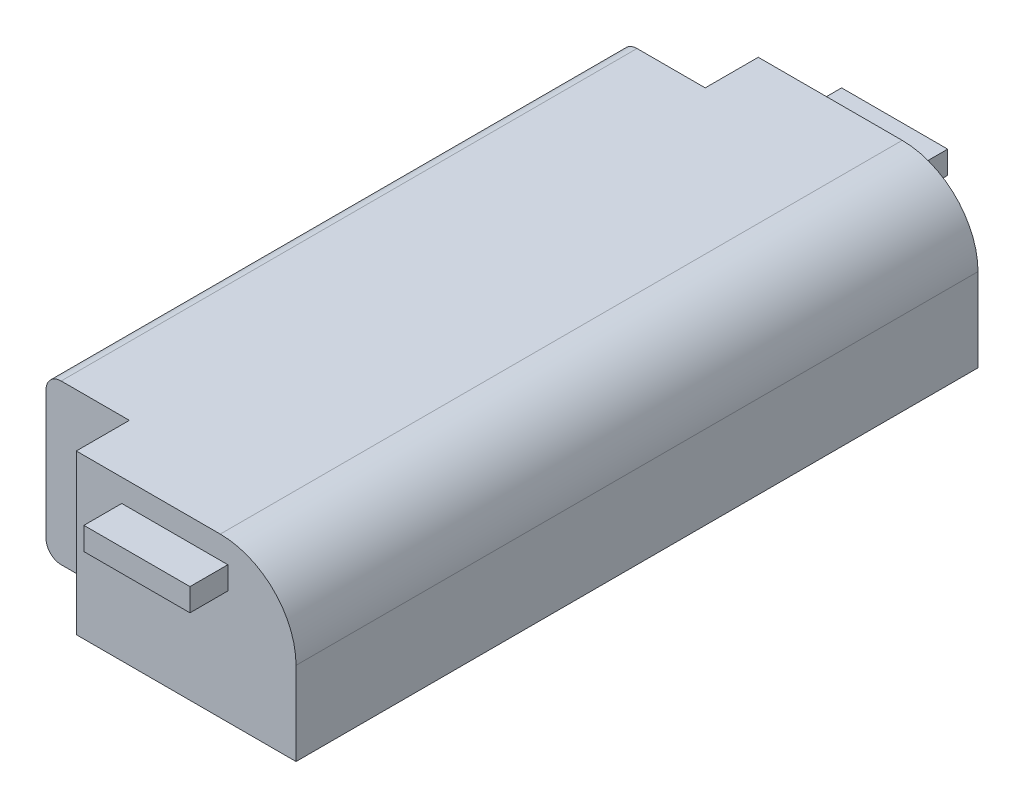
from build123d import *

# Parameters (mm, degrees)
BOSS_EXTRUDE1_DEPTH = 96.52
SKETCH3_W           = 36.83
SKETCH3_H           = 26.67
BOSS_EXTRUDE3_DEPTH = 8.89
SKETCH2_W           = 17.78
SKETCH2_H           = 3.81
BOSS_EXTRUDE4_DEPTH = 6.35
FILLET1_R           = 12.7
FILLET2_R           = 2.54


with BuildPart() as part:
    # Sketch1 → Boss-Extrude1 (new body)
    with BuildSketch(Plane.XY):
        Polygon((0, 0), (0, -20.32), (-7.62, -20.32), (-7.62, 6.35), (43.18, 6.35), (43.18, -20.32), (6.35, -20.32), (6.35, 0), align=None)
    extrude(amount=BOSS_EXTRUDE1_DEPTH)

    # Sketch3 → Boss-Extrude3 (add)
    with BuildSketch(Plane.XY.offset(96.52)):
        with Locations((24.765, -6.985)):
            Rectangle(SKETCH3_W, SKETCH3_H)
    boss_extrude3 = extrude(amount=BOSS_EXTRUDE3_DEPTH)

    # Sketch2 → Boss-Extrude4 (add)
    with BuildSketch(Plane(origin=(0, 0, 105.41), x_dir=(-1, 0, 0), z_dir=(0, 0, -1))):
        with Locations((-22.86, 0.635)):
            Rectangle(SKETCH2_W, SKETCH2_H)
    boss_extrude4 = extrude(amount=-BOSS_EXTRUDE4_DEPTH)

    # Mirror2: Boss-Extrude3, Boss-Extrude4 across plane
    add(boss_extrude3.mirror(Plane(origin=(0, 0, 48.26), x_dir=(1, 0, 0), z_dir=(0, 0, -1))))
    add(boss_extrude4.mirror(Plane(origin=(0, 0, 48.26), x_dir=(1, 0, 0), z_dir=(0, 0, -1))))

    # Fillet1
    fillet1_edges = [part.edges().sort_by_distance(p)[0] for p in [
        (43.18, 6.35, 48.26),
    ]]
    fillet(fillet1_edges, radius=FILLET1_R)

    # Fillet2
    fillet2_edges = [part.edges().sort_by_distance(p)[0] for p in [
        (-7.62, -20.32, 48.26),
        (-7.62, 6.35, 48.26),
    ]]
    fillet(fillet2_edges, radius=FILLET2_R)


solid = part.part
